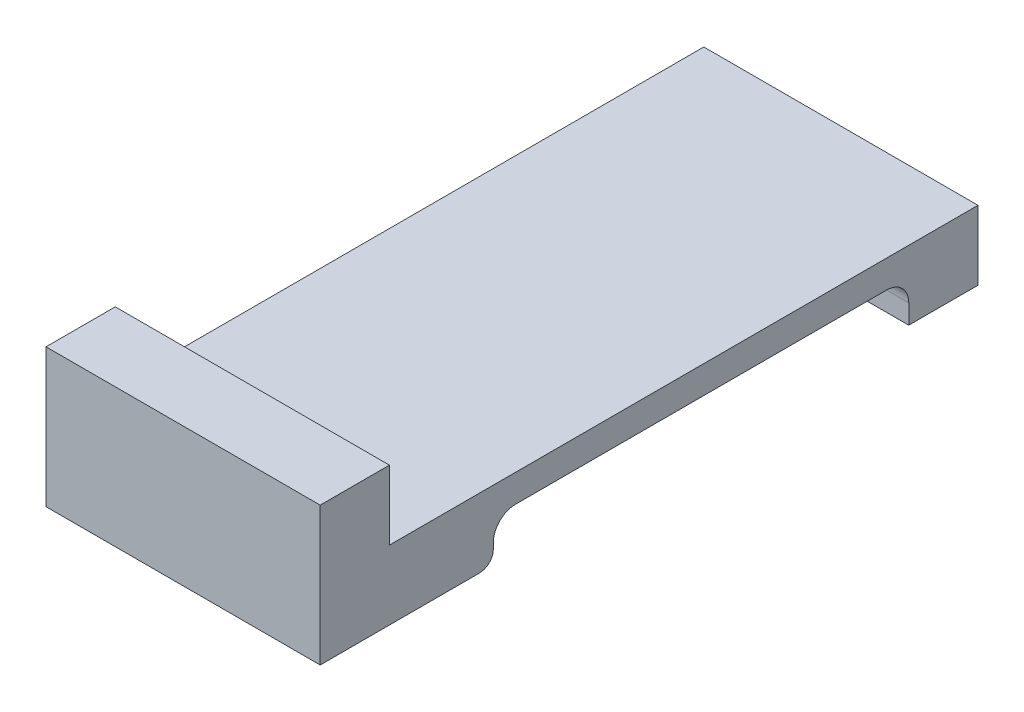
from build123d import *

# Parameters (mm, degrees)
BOSS_EXTRUDE1_DEPTH = 12.573


with BuildPart() as part:
    # Sketch1 → Boss-Extrude1 (new body)
    with BuildSketch(Plane(origin=(0, 0, 0), x_dir=(0, 0, -1), z_dir=(1, 0, 0))):
        with BuildLine():
            Line((0, 0), (0, 6.35))
            Line((0, 6.35), (3.175, 6.35))
            Line((3.175, 6.35), (3.175, 3.175))
            Line((3.175, 3.175), (30.1625, 3.175))
            Line((30.1625, 3.175), (30.1625, 0))
            Line((30.1625, 0), (26.9875, 0))
            Line((26.9875, 0), (26.9875, 0.889))
            ThreePointArc((26.9875, 0.889), (26.68992049, 1.60742049), (25.9715, 1.905))
            Line((25.9715, 1.905), (8.9535, 1.905))
            ThreePointArc((8.9535, 1.905), (8.23507951, 1.60742049), (7.9375, 0.889))
            Line((7.9375, 0.889), (7.9375, 0.635))
            ThreePointArc((7.9375, 0.635), (7.751512806, 0.185987194), (7.3025, 0))
            Line((7.3025, 0), (0, 0))
        make_face()
    extrude(amount=BOSS_EXTRUDE1_DEPTH)


solid = part.part
